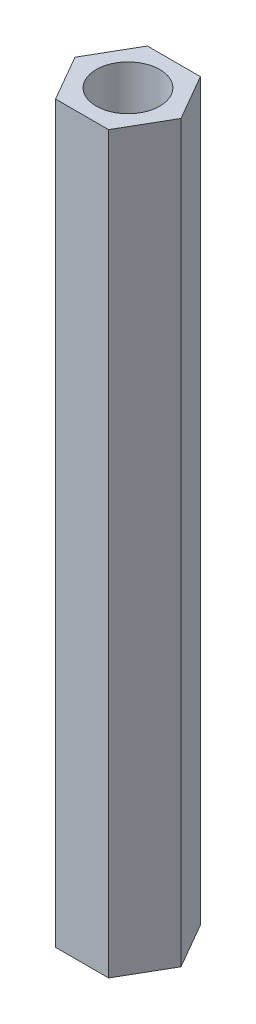
from build123d import *

# Parameters (mm, degrees)
BOSS_EXTRUDE1_DEPTH         = 50.8
TAP_DRILL_FOR_8_HELICOIL1_D = 4.3942


with BuildPart() as part:
    # Sketch1 → Boss-Extrude1 (new body)
    with BuildSketch(Plane(origin=(0, 0, 0), x_dir=(1, 0, 0), z_dir=(0, 1, 0))):
        Polygon((1.833087105, 3.175), (-1.833087105, 3.175), (-3.666174209, 0), (-1.833087105, -3.175), (1.833087105, -3.175), (3.666174209, 0), align=None)
    extrude(amount=BOSS_EXTRUDE1_DEPTH)

    # Tap Drill for #8 Helicoil1 (through all)
    with Locations(Plane(origin=(0, 50.8, 0), x_dir=(1, 0, 0), z_dir=(0, 1, 0))):
        with Locations((0, 0)):
            Hole(TAP_DRILL_FOR_8_HELICOIL1_D / 2)


solid = part.part
